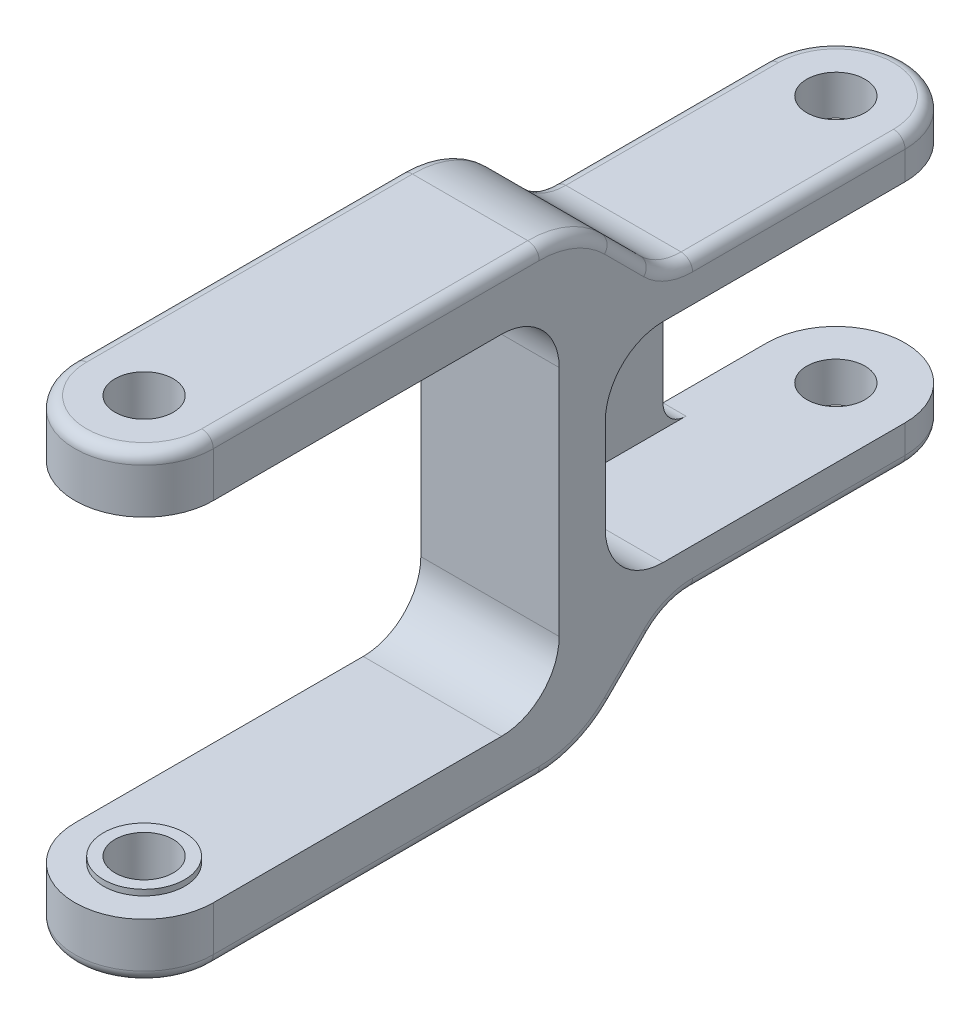
from build123d import *

# Parameters (mm, degrees)
SKETCH_1_R          = 2.525
EXTRUDE_1_DEPTH     = 20
SKETCH_2_W          = 36
SKETCH_2_H          = 30.2
SKETCH_2_W_2        = 17
SKETCH_2_H_2        = 18.1
CUT_EXTRUDE_1_DEPTH = 28
SKETCH_3_W          = 15
SKETCH_3_H          = 18.1
CUT_EXTRUDE_2_DEPTH = 10
FILLET_2_R          = 9
FILLET_3_R          = 5
FILLET_4_R          = 5
FILLET_5_R          = 5
FILLET_6_R          = 2
FILLET_7_R          = 1
EXTRUDE_START       = 0.5
SKETCH_4_R          = 3.525
SKETCH_4_R_2        = 2.525
EXTRUDE_2_DEPTH     = 0.5


with BuildPart() as part:
    # 草图1 → 凸台-拉伸1 (new, symmetric)
    with BuildSketch(Plane(origin=(0, 0, 0), x_dir=(1, 0, 0), z_dir=(0, 1, 0))):
        with BuildLine():
            Line((-6, 0), (-6, 60))
            ThreePointArc((-6, 60), (0, 66), (6, 60))
            Line((6, 60), (6, 0))
            ThreePointArc((6, 0), (0, -6), (-6, 0))
        make_face()
        with Locations(Location((0, 60, 0), (0, 0, 270))):
            Circle(SKETCH_1_R, mode=Mode.SUBTRACT)
        with Locations(Location((0, 0, 0), (0, 0, 270))):
            Circle(SKETCH_1_R, mode=Mode.SUBTRACT)
    extrude(amount=EXTRUDE_1_DEPTH, both=True)

    # 草图2 → 切除-拉伸1 (cut)
    with BuildSketch(Plane.ZY.offset(6)):
        with Locations((-12, 0)):
            Rectangle(SKETCH_2_W, SKETCH_2_H)
        with Locations((-57.5, 0)):
            Rectangle(SKETCH_2_W_2, SKETCH_2_H_2)
        Polygon((-32, 20), (-39.5, 12.5), (-66, 12.5), (-66, 20), align=None)
        Polygon((-66, -12.5), (-66, -20), (-32, -20), (-39.5, -12.5), align=None)
    extrude(amount=-CUT_EXTRUDE_1_DEPTH, mode=Mode.SUBTRACT)

    # 草图3 → 切除-拉伸2 (cut)
    with BuildSketch(Plane(origin=(6, 0, 0), x_dir=(0, 0, -1), z_dir=(1, 0, 0))):
        with Locations((41.5, 0)):
            Rectangle(SKETCH_3_W, SKETCH_3_H)
    extrude(amount=-CUT_EXTRUDE_2_DEPTH, mode=Mode.SUBTRACT)

    # 圆角2
    fillet_2_edges = [part.edges().sort_by_distance(p)[0] for p in [
        (0, 20, -32),
        (0, -20, -32),
    ]]
    fillet(fillet_2_edges, radius=FILLET_2_R)

    # 圆角3
    fillet_3_edges = [part.edges().sort_by_distance(p)[0] for p in [
        (0, 12.5, -39.5),
        (0, -12.5, -39.5),
    ]]
    fillet(fillet_3_edges, radius=FILLET_3_R)

    # 圆角4
    fillet_4_edges = [part.edges().sort_by_distance(p)[0] for p in [
        (0, -15.1, -30),
        (0, 15.1, -30),
    ]]
    fillet(fillet_4_edges, radius=FILLET_4_R)

    # 圆角5
    fillet_5_edges = [part.edges().sort_by_distance(p)[0] for p in [
        (1, -9.05, -34),
        (1, 9.05, -34),
    ]]
    fillet(fillet_5_edges, radius=FILLET_5_R)

    # 圆角6
    fillet_6_edges = [part.edges().sort_by_distance(p)[0] for p in [
        (-5, -9.05, -49),
        (-5, 9.05, -49),
    ]]
    fillet(fillet_6_edges, radius=FILLET_6_R)

    # 圆角7
    fillet_7_edges = [part.edges().sort_by_distance(p)[0] for p in [
        (-6, 20, -14.136038969),
        (-6, -15.664213562, -36.335786438),
        (-6, -20, -14.136038969),
        (-6, -19.314915793, -31.71622883),
        (-6, 19.314915793, -31.71622883),
        (6, -15.664213562, -36.335786438),
        (6, -19.314915793, -31.71622883),
        (6, 19.314915793, -31.71622883),
        (-6, 15.664213562, -36.335786438),
        (6, 15.664213562, -36.335786438),
        (-6, -12.5, -50.785533906),
        (6, -12.5, -50.785533906),
        (-6, 12.880602337, -39.65765065),
        (6, 12.880602337, -39.65765065),
        (-6, -12.880602337, -39.65765065),
        (6, -12.880602337, -39.65765065),
        (0, 20, 6),
        (6, -20, -14.136038969),
        (0, -20, 6),
        (-6, 12.5, -50.785533906),
        (0, 12.5, -66),
        (6, 12.5, -50.785533906),
        (0, -12.5, -66),
        (6, 20, -14.136038969),
    ]]
    fillet(fillet_7_edges, radius=FILLET_7_R)

    # 草图4 → 凸台-拉伸2 (add)
    with BuildSketch(Plane.XZ.offset(-15.1).offset(EXTRUDE_START)):
        with Locations(Location((0, 0, 0), (0, 0, 90))):
            Circle(SKETCH_4_R)
        with Locations(Location((0, 0, 0), (0, 0, 270))):
            Circle(SKETCH_4_R_2, mode=Mode.SUBTRACT)
    extrude_2 = extrude(amount=-EXTRUDE_2_DEPTH)

    # 镜向1: 凸台-拉伸2 across plane
    add(extrude_2.mirror(Plane(origin=(0, 0, 0), x_dir=(0, 0, 1), z_dir=(0, -1, 0))))


solid = part.part
